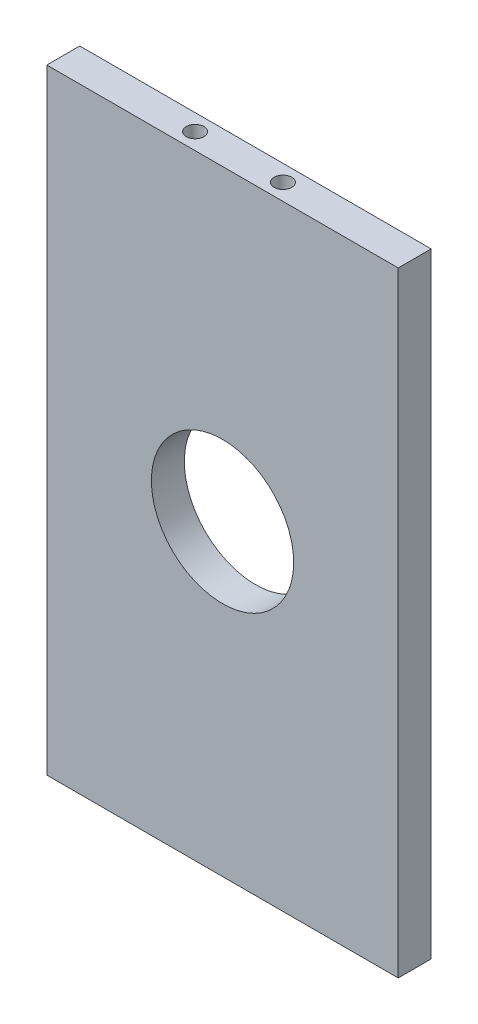
from build123d import *

# Parameters (mm, degrees)
SKETCH1_W                        = 203.2
SKETCH1_H                        = 304.8
BOSS_EXTRUDE1_DEPTH              = 9.525
CUT_EXTRUDE1_REACH               = 185.41
SKETCH2_R                        = 20.574
CUT_EXTRUDE2_REACH               = 185.41
SKETCH3_W                        = 203.2
SKETCH3_H                        = 63.5
F_1_4_20_TAPPED_HOLE1_AT_2_COUNT = 2
F_1_4_20_TAPPED_HOLE1_AT_2_PITCH = 25.4
CUT_EXTRUDE3_REACH               = 137.338
SKETCH6_W                        = 50.8
SKETCH6_H                        = 177.8


with BuildPart() as part:
    # Sketch1 → Boss-Extrude1 (new body)
    with BuildSketch(Plane.XY):
        Rectangle(SKETCH1_W, SKETCH1_H)
    extrude(amount=BOSS_EXTRUDE1_DEPTH)

    # Sketch2 → Cut-Extrude1 (cut, up to next)
    with BuildSketch(Plane.XY.offset(9.525), mode=Mode.PRIVATE) as cut_extrude1_sk1:
        Circle(SKETCH2_R)
    cut_extrude1_tool1 = extrude(cut_extrude1_sk1.sketch, amount=-CUT_EXTRUDE1_REACH, mode=Mode.PRIVATE) & part.part
    add(cut_extrude1_tool1.solids().sort_by_distance((0, 0, 9.525))[0], mode=Mode.SUBTRACT)

    # Sketch3 → Cut-Extrude2 (cut, up to next)
    with BuildSketch(Plane.XY.offset(9.525), mode=Mode.PRIVATE) as cut_extrude2_sk1:
        with Locations((0, -120.65)):
            Rectangle(SKETCH3_W, SKETCH3_H)
    cut_extrude2_tool1 = extrude(cut_extrude2_sk1.sketch, amount=-CUT_EXTRUDE2_REACH, mode=Mode.PRIVATE) & part.part
    # Sketch3 → Cut-Extrude2 (cut, up to next)
    with BuildSketch(Plane.XY.offset(9.525), mode=Mode.PRIVATE) as cut_extrude2_sk2:
        with Locations((0, 120.65)):
            Rectangle(SKETCH3_W, SKETCH3_H)
    cut_extrude2_tool2 = extrude(cut_extrude2_sk2.sketch, amount=-CUT_EXTRUDE2_REACH, mode=Mode.PRIVATE) & part.part
    add(cut_extrude2_tool1.solids().sort_by_distance((0, -120.65, 9.525))[0], mode=Mode.SUBTRACT)
    add(cut_extrude2_tool2.solids().sort_by_distance((0, 120.65, 9.525))[0], mode=Mode.SUBTRACT)

    # Sketch5 → 1/4-20 Tapped Hole1 (revolve, cut)
    with BuildSketch(Plane(origin=(-12.7, 88.9, 4.7625), x_dir=(0, 0, 1), z_dir=(1, 0, 0))):
        Polygon((0, 0), (0, 20.583816902), (2.5527, 19.05), (2.5527, 0), align=None)
    f_1_4_20_tapped_hole1 = revolve(axis=Axis((-12.7, 95.25, 4.7625), (0, -1, 0)), mode=Mode.SUBTRACT)

    # 1/4-20 Tapped Hole1 at 2: 1/4-20 Tapped Hole1 ×2
    with Locations(*[(i * F_1_4_20_TAPPED_HOLE1_AT_2_PITCH, 0, 0) for i in range(1, F_1_4_20_TAPPED_HOLE1_AT_2_COUNT)]):
        add(f_1_4_20_tapped_hole1, mode=Mode.SUBTRACT)

    # Mirror1: 1/4-20 Tapped Hole1 across plane
    add(f_1_4_20_tapped_hole1.mirror(Plane.ZX), mode=Mode.SUBTRACT)

    # Mirror1 copy 1 sketch → Mirror1 copy 1 (revolve, cut)
    with BuildSketch(Plane(origin=(12.7, -88.9, 4.7625), x_dir=(0, 0, 1), z_dir=(1, 0, 0))):
        Polygon((0, 0), (0, -20.583816902), (2.5527, -19.05), (2.5527, 0), align=None)
    revolve(axis=Axis((12.7, -95.25, 4.7625), (0, -1, 0)), mode=Mode.SUBTRACT)

    # Sketch6 → Cut-Extrude3 (cut, up to next)
    with BuildSketch(Plane.XY.offset(9.525), mode=Mode.PRIVATE) as cut_extrude3_sk1:
        with Locations((-76.2, 0)):
            Rectangle(SKETCH6_W, SKETCH6_H)
    cut_extrude3_tool1 = extrude(cut_extrude3_sk1.sketch, amount=-CUT_EXTRUDE3_REACH, mode=Mode.PRIVATE) & part.part
    # Sketch6 → Cut-Extrude3 (cut, up to next)
    with BuildSketch(Plane.XY.offset(9.525), mode=Mode.PRIVATE) as cut_extrude3_sk2:
        with Locations((76.2, 0)):
            Rectangle(SKETCH6_W, SKETCH6_H)
    cut_extrude3_tool2 = extrude(cut_extrude3_sk2.sketch, amount=-CUT_EXTRUDE3_REACH, mode=Mode.PRIVATE) & part.part
    add(cut_extrude3_tool1.solids().sort_by_distance((-76.2, 0, 9.525))[0], mode=Mode.SUBTRACT)
    add(cut_extrude3_tool2.solids().sort_by_distance((76.2, 0, 9.525))[0], mode=Mode.SUBTRACT)


solid = part.part
